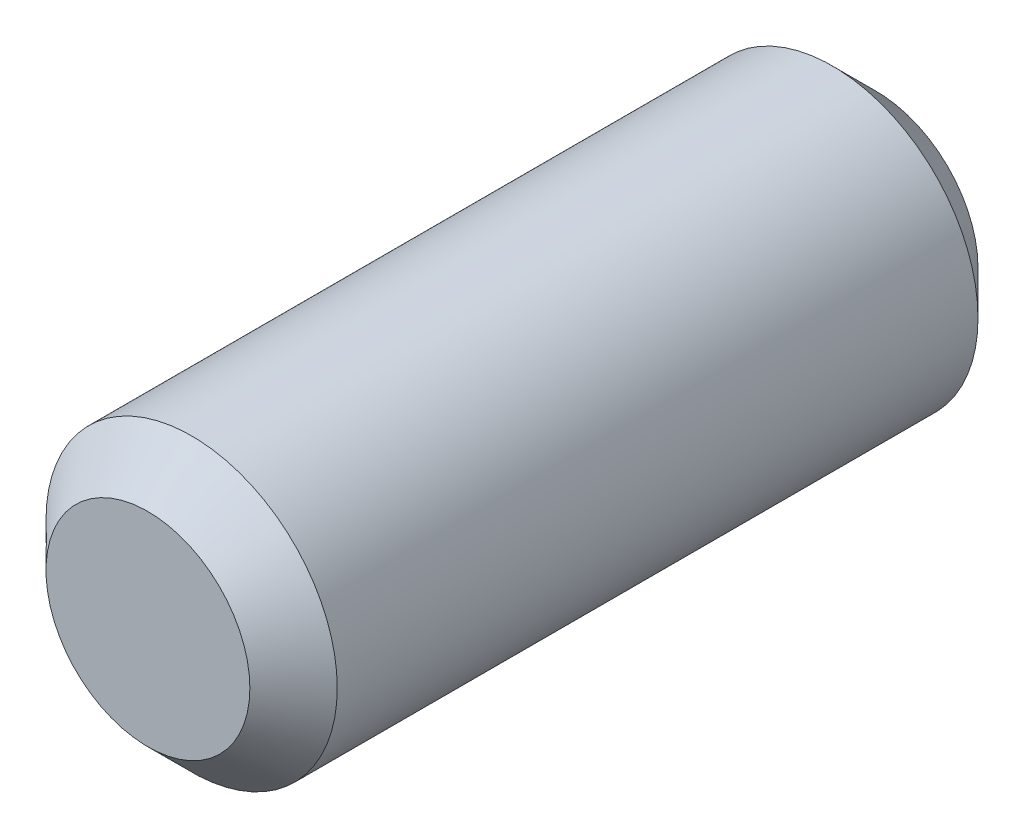
from build123d import *

# Parameters (mm, degrees)
RESSALTO_EXTRUS_O1_DEPTH      = 2.5
RESSALTO_EXTRUS_O1_DEPTH_BACK = 2.5
ESBO_O1_R                     = 1
CHANFRO1_SIZE                 = 0.3


with BuildPart() as part:
    # Esboço1 → Ressalto-extrusão1 (new, two sides: drawn at the far end of the back side and taken through both)
    with BuildSketch(Plane.XY.offset(-RESSALTO_EXTRUS_O1_DEPTH_BACK)):
        Circle(ESBO_O1_R)
    extrude(amount=RESSALTO_EXTRUS_O1_DEPTH + RESSALTO_EXTRUS_O1_DEPTH_BACK)

    # Chanfro1
    chanfro1_edges = [part.edges().sort_by_distance(p)[0] for p in [
        (-1, 0, -2.5),
        (-1, 0, 2.5),
    ]]
    chamfer(chanfro1_edges, length=CHANFRO1_SIZE)


solid = part.part
